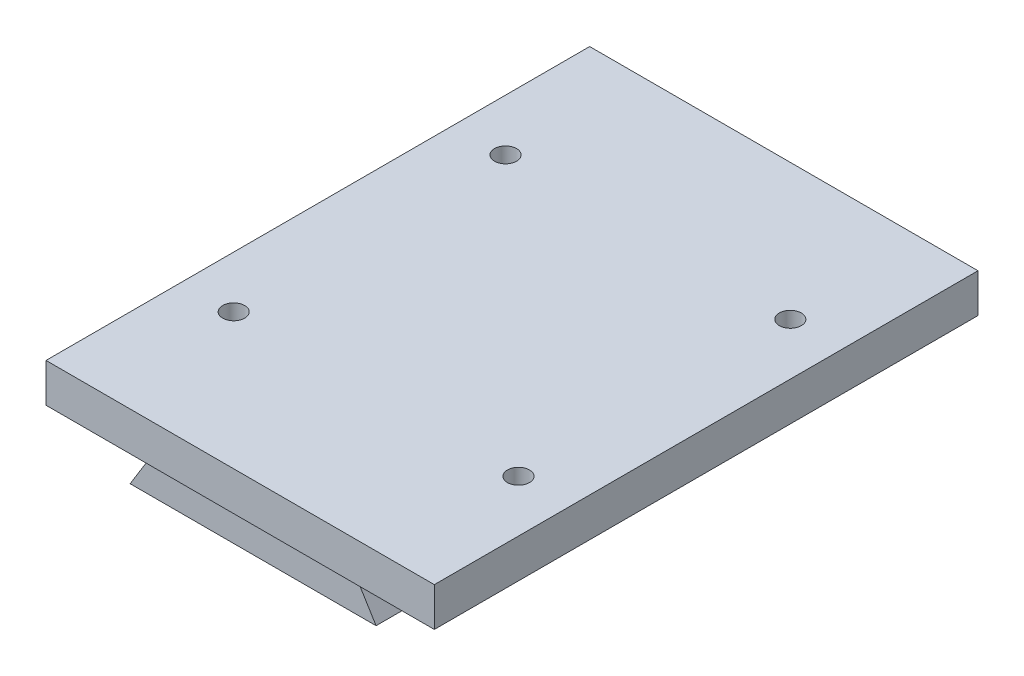
from build123d import *

# Parameters (mm, degrees)
SKETCH1_W           = 60
SKETCH1_H           = 84
RAIL_PLATE_DEPTH    = 6
DOVETAIL_RAIL_DEPTH = 80
SKETCH3_R           = 1.7
M3_HOLES_DEPTH      = 7
SKETCH4_R           = 3
COUNTERBORES_DEPTH  = 4


with BuildPart() as part:
    # Sketch1 → Rail Plate (new body)
    with BuildSketch(Plane(origin=(0, -34.4, 0), x_dir=(1, 0, 0), z_dir=(0, 1, 0))):
        with Locations((0, -70)):
            Rectangle(SKETCH1_W, SKETCH1_H)
    extrude(amount=RAIL_PLATE_DEPTH)

    # Sketch2 → Dovetail Rail (add)
    with BuildSketch(Plane.XY.offset(30)):
        Polygon((-15, -33.9), (15, -33.9), (19, -40.4), (-19, -40.4), align=None)
    extrude(amount=DOVETAIL_RAIL_DEPTH)

    # Sketch3 → M3 Holes (cut)
    with BuildSketch(Plane(origin=(0, -34.9, 0), x_dir=(1, 0, 0), z_dir=(0, 1, 0))):
        with Locations(Location((-22, -91, 0), (0, 0, 270))):
            Circle(SKETCH3_R)
        with Locations(Location((-22, -49, 0), (0, 0, 270))):
            Circle(SKETCH3_R)
        with Locations(Location((22, -91, 0), (0, 0, 270))):
            Circle(SKETCH3_R)
        with Locations(Location((22, -49, 0), (0, 0, 270))):
            Circle(SKETCH3_R)
    extrude(amount=M3_HOLES_DEPTH, mode=Mode.SUBTRACT)

    # Sketch4 → Counterbores (cut)
    with BuildSketch(Plane(origin=(0, -34.9, 0), x_dir=(1, 0, 0), z_dir=(0, 1, 0))):
        with Locations(Location((-22, -91, 0), (0, 0, 270))):
            Circle(SKETCH4_R)
        with Locations(Location((-22, -49, 0), (0, 0, 270))):
            Circle(SKETCH4_R)
        with Locations(Location((22, -91, 0), (0, 0, 270))):
            Circle(SKETCH4_R)
        with Locations(Location((22, -49, 0), (0, 0, 270))):
            Circle(SKETCH4_R)
    extrude(amount=COUNTERBORES_DEPTH, mode=Mode.SUBTRACT)


solid = part.part
